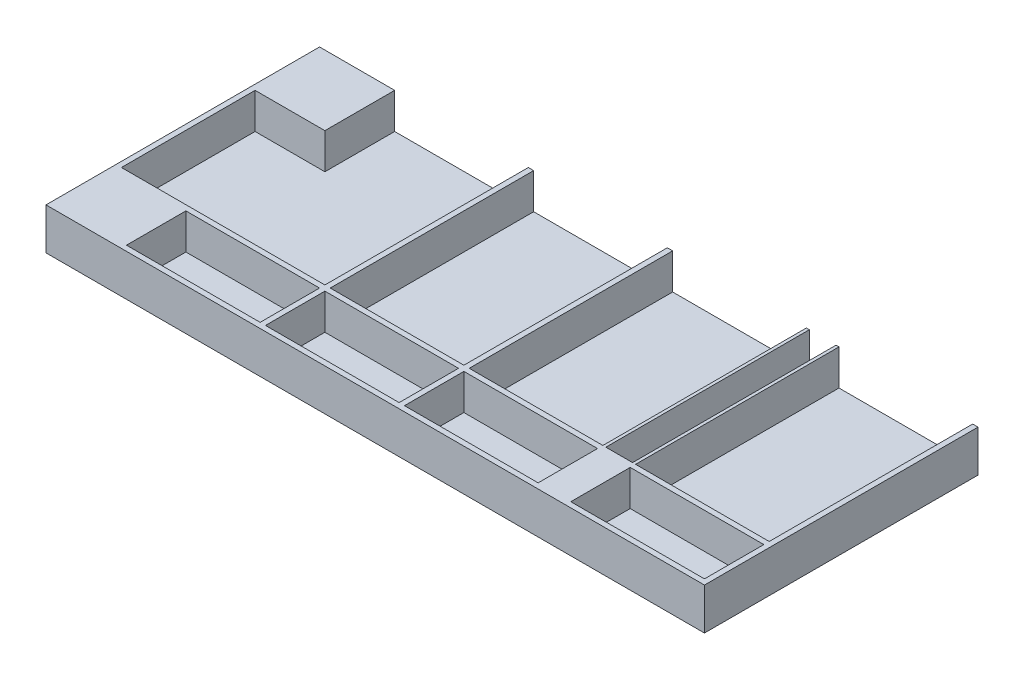
from build123d import *

# Parameters (mm, degrees)
SKETCH1_W           = 221.7
SKETCH1_H           = 92.1
BOSS_EXTRUDE1_DEPTH = 2
SKETCH1_3_W         = 45
SKETCH1_3_H         = 20
BOSS_EXTRUDE2_DEPTH = 12


with BuildPart() as part:
    # Sketch1 → Boss-Extrude1 (new body)
    with BuildSketch(Plane(origin=(0, 0, 0), x_dir=(1, 0, 0), z_dir=(0, 1, 0))):
        with Locations((110.85, 46.05)):
            Rectangle(SKETCH1_W, SKETCH1_H)
    extrude(amount=-BOSS_EXTRUDE1_DEPTH)

    # Sketch1<3> → Boss-Extrude2 (add)
    with BuildSketch(Plane(origin=(0, 0, 0), x_dir=(1, 0, 0), z_dir=(0, 1, 0))):
        Polygon((0, 92.1), (0, 0), (221.7, 0), (221.7, 92.1), (219.9, 92.1), (219.9, 23.6), (174.9, 23.6), (174.9, 92.1), (173.9, 92.1), (173.9, 23.6), (164.9, 23.6), (164.9, 92.1), (163.9, 92.1), (163.9, 23.6), (118.9, 23.6), (118.9, 92.1), (117.1, 92.1), (117.1, 23.6), (72.1, 23.6), (72.1, 92.1), (70.3, 92.1), (70.3, 23.6), (1.8, 23.6), (1.8, 68.6), (25.3, 68.6), (25.3, 92.1), align=None)
        with Locations((47.8, 11.8)):
            Rectangle(SKETCH1_3_W, SKETCH1_3_H, mode=Mode.SUBTRACT)
        with Locations((94.6, 11.8)):
            Rectangle(SKETCH1_3_W, SKETCH1_3_H, mode=Mode.SUBTRACT)
        with Locations((141.4, 11.8)):
            Rectangle(SKETCH1_3_W, SKETCH1_3_H, mode=Mode.SUBTRACT)
        with Locations((197.4, 11.8)):
            Rectangle(SKETCH1_3_W, SKETCH1_3_H, mode=Mode.SUBTRACT)
    extrude(amount=BOSS_EXTRUDE2_DEPTH)


solid = part.part
